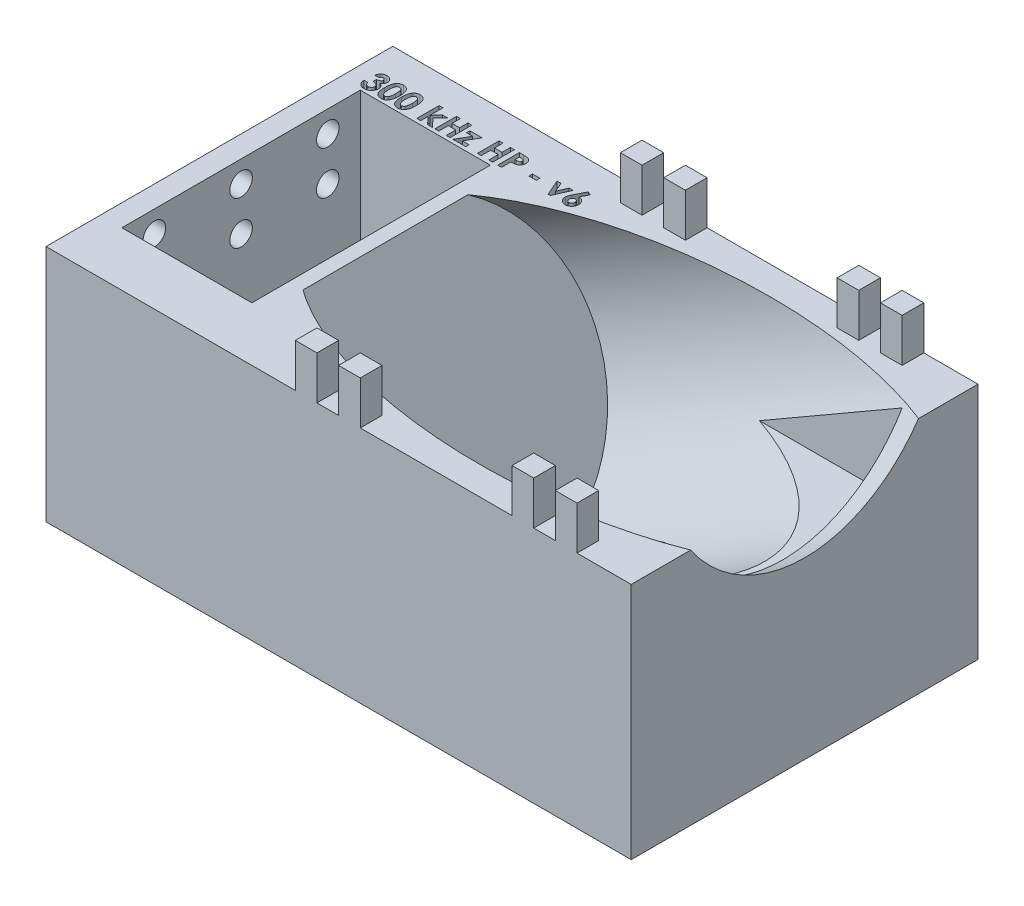
from build123d import *

# Parameters (mm, degrees)
SKETCH1_W                = 228.6
SKETCH1_H                = 127
BOSS_EXTRUDE1_DEPTH      = 50.8
SKETCH10_R               = 12.7
CUT_EXTRUDE6_DEPTH       = 196.514014843
SKETCH13_W               = 6.35
SKETCH13_H               = 6.35
BOSS_EXTRUDE3_DEPTH      = 12.7
SKETCH22_W               = 25.4
SKETCH22_H               = 101.6
CUT_EXTRUDE17_DEPTH      = 196.514014908
SKETCH23_W               = 254
SKETCH23_H               = 254
CUT_EXTRUDE18_DEPTH      = 57.15
SKETCH21_W               = 31.75
SKETCH21_H               = 101.6
CUT_EXTRUDE16_DEPTH      = 144.262530042
SKETCH26_W               = 88.9
SKETCH26_H               = 69.85
CUT_EXTRUDE21_DEPTH      = 25.4
CUT_EXTRUDE22_DEPTH      = 192.97594914
CUT_EXTRUDE22_DEPTH_BACK = 25.4
SKETCH27_R               = 3.302
SKETCH28_W               = 2.198076923
SKETCH28_H               = 1.058333333
CUT_EXTRUDE23_DEPTH      = 3.175
SKETCH30_R               = 3.429
CUT_EXTRUDE24_DEPTH      = 133.743860656
CUT_EXTRUDE25_DEPTH      = 133.743860656
CUT_EXTRUDE25_DEPTH_BACK = 38.1
SKETCH31_W               = 38.1
SKETCH31_H               = 69.85


with BuildPart() as part:
    # Sketch1 → Boss-Extrude1 (new, symmetric)
    with BuildSketch(Plane.XY):
        with Locations((-25.4, -63.5)):
            Rectangle(SKETCH1_W, SKETCH1_H)
    extrude(amount=BOSS_EXTRUDE1_DEPTH, both=True)

    # Sketch10 → Cut-Extrude6 (cut, through all)
    with BuildSketch(Plane.XZ.offset(127)):
        with Locations(Location((0, 0, 0), (0, 0, 270))):
            Circle(SKETCH10_R)
    extrude(amount=-CUT_EXTRUDE6_DEPTH, mode=Mode.SUBTRACT)

    # Sketch2 → Cut-Revolve1 (revolve, cut)
    with BuildSketch(Plane.XY):
        Polygon((0, 46.586734405), (-47.920101674, 18.920050804), (-69.397531628, 6.520050839), (-50.142509297, -26.830626138), (-48.125031628, -30.324999965), (0, -2.54), (87.988181024, 48.26), (66.715681024, 85.105050804), align=None)
    revolve(axis=Axis((-48.125031628, -30.324999965, 0), (0.8660254037844379, 0.5000000000000012, 0)), mode=Mode.SUBTRACT)

    # Sketch13 → Boss-Extrude3 (add)
    with BuildSketch(Plane(origin=(0, 0, 0), x_dir=(1, 0, 0), z_dir=(0, 1, 0))):
        with Locations((-38.1, 47.625)):
            Rectangle(SKETCH13_W, SKETCH13_H)
        with Locations((-25.4, 47.625)):
            Rectangle(SKETCH13_W, SKETCH13_H)
        with Locations((25.4, 47.625)):
            Rectangle(SKETCH13_W, SKETCH13_H)
        with Locations((38.1, 47.625)):
            Rectangle(SKETCH13_W, SKETCH13_H)
        with Locations((38.1, -47.625)):
            Rectangle(SKETCH13_W, SKETCH13_H)
        with Locations((25.4, -47.625)):
            Rectangle(SKETCH13_W, SKETCH13_H)
        with Locations((-25.4, -47.625)):
            Rectangle(SKETCH13_W, SKETCH13_H)
        with Locations((-38.1, -47.625)):
            Rectangle(SKETCH13_W, SKETCH13_H)
    extrude(amount=BOSS_EXTRUDE3_DEPTH)

    # Sketch22 → Cut-Extrude17 (cut, through all)
    with BuildSketch(Plane(origin=(0, 0, 0), x_dir=(1, 0, 0), z_dir=(0, 1, 0))):
        with Locations((-127, 0)):
            Rectangle(SKETCH22_W, SKETCH22_H)
    extrude(amount=-CUT_EXTRUDE17_DEPTH, mode=Mode.SUBTRACT)

    # Sketch23 → Cut-Extrude18 (cut)
    with BuildSketch(Plane.XZ.offset(127)):
        Rectangle(SKETCH23_W, SKETCH23_H)
    extrude(amount=-CUT_EXTRUDE18_DEPTH, mode=Mode.SUBTRACT)

    # Sketch21 → Cut-Extrude16 (cut, through all)
    with BuildSketch(Plane(origin=(0, 0, 0), x_dir=(1, 0, 0), z_dir=(0, 1, 0))):
        with Locations((73.025, 0)):
            Rectangle(SKETCH21_W, SKETCH21_H)
    extrude(amount=-CUT_EXTRUDE16_DEPTH, mode=Mode.SUBTRACT)

    # Sketch26 → Cut-Extrude21 (cut)
    with BuildSketch(Plane(origin=(0, 0, 0), x_dir=(1, 0, 0), z_dir=(0, 1, 0))):
        with Locations((6.35, 0)):
            Rectangle(SKETCH26_W, SKETCH26_H)
    extrude(amount=-CUT_EXTRUDE21_DEPTH, mode=Mode.SUBTRACT)

    # Sketch27 → Cut-Extrude22 (cut, two sides: drawn at the far end of the back side and taken through both)
    with BuildSketch(Plane.ZY.offset(114.3).offset(-CUT_EXTRUDE22_DEPTH_BACK)):
        with Locations(Location((-25.4, -6.35, 0), (0, 0, 180))):
            Circle(SKETCH27_R)
        with Locations(Location((0, -6.35, 0), (0, 0, 180))):
            Circle(SKETCH27_R)
        with Locations(Location((0, -19.05, 0), (0, 0, 180))):
            Circle(SKETCH27_R)
        with Locations(Location((25.4, -6.35, 0), (0, 0, 180))):
            Circle(SKETCH27_R)
        with Locations(Location((25.4, -19.05, 0), (0, 0, 180))):
            Circle(SKETCH27_R)
        with Locations(Location((-25.4, -19.05, 0), (0, 0, 180))):
            Circle(SKETCH27_R)
    extrude(amount=CUT_EXTRUDE22_DEPTH + CUT_EXTRUDE22_DEPTH_BACK, mode=Mode.SUBTRACT)

    # Sketch28 → Cut-Extrude23 (cut)
    # profile 1 of 11: a face of its own
    with BuildSketch(Plane(origin=(0, 0, 0), x_dir=(1, 0, 0), z_dir=(0, 1, 0))):
        with BuildLine():
            Line((-108.439595668, 40.823041991), (-109.579339258, 40.823041991))
            add(Edge.make_bspline(
                [(-109.579339258, 40.823041991), (-109.571292235, 40.880013707), (-109.555516579, 40.991702982), (-109.517767544, 41.15340123), (-109.472615625, 41.306783084), (-109.41624576, 41.451362816), (-109.35013308, 41.587397969), (-109.274949876, 41.71535535), (-109.18988339, 41.834685743), (-109.124679027, 41.906570845), (-109.092149755, 41.942433016)],
                knots=[0, 0, 0, 0, 1.111473889, 2.178970933, 3.205615836, 4.199322666, 5.174200091, 6.12565194, 7.064921805, 8, 8, 8, 8], degree=3))
            add(Edge.make_bspline(
                [(-109.092149755, 41.942433016), (-109.04523059, 41.989750553), (-108.952757848, 42.083008445), (-108.798225049, 42.202461503), (-108.636246138, 42.305840002), (-108.463572556, 42.387799223), (-108.282891233, 42.454135718), (-108.092765331, 42.498694091), (-107.893971771, 42.528258965), (-107.758320175, 42.531171208), (-107.689094867, 42.532657375)],
                knots=[0, 0, 0, 0, 1.01925491, 2.00884431, 2.983262333, 3.955970413, 4.92937149, 5.924503185, 6.940838805, 8, 8, 8, 8], degree=3))
            add(Edge.make_bspline(
                [(-107.689094867, 42.532657375), (-107.627550006, 42.531204422), (-107.506565211, 42.528348208), (-107.328748005, 42.505420072), (-107.15921418, 42.465206676), (-106.996171714, 42.412628563), (-106.84201843, 42.341087252), (-106.693352017, 42.258043018), (-106.554326218, 42.156185813), (-106.42461574, 42.041097423), (-106.305451927, 41.916618062), (-106.202255542, 41.783559862), (-106.113535759, 41.645477115), (-106.040442393, 41.501222613), (-105.984243527, 41.350552262), (-105.945239847, 41.194336462), (-105.919710992, 41.032919917), (-105.917167651, 40.923207266), (-105.915877719, 40.867563225)],
                knots=[0, 0, 0, 0, 1.091422571, 2.145516843, 3.172569842, 4.178562979, 5.178154469, 6.181868002, 7.194278174, 8.227918432, 9.254613415, 10.245994977, 11.209837596, 12.161663635, 13.10878368, 14.055455738, 15.013766427, 16, 16, 16, 16], degree=3))
            add(Edge.make_bspline(
                [(-105.915877719, 40.867563225), (-105.918524735, 40.798652714), (-105.923735896, 40.662989104), (-105.966497241, 40.464435331), (-106.033430374, 40.274582491), (-106.130121795, 40.09608691), (-106.251010699, 39.929434354), (-106.399337334, 39.780196517), (-106.570876975, 39.646033552), (-106.699654067, 39.573934358), (-106.765597271, 39.537014347)],
                knots=[0, 0, 0, 0, 0.992805628, 1.954529043, 2.915727527, 3.886831945, 4.871318353, 5.87440735, 6.911542536, 8, 8, 8, 8], degree=3))
            add(Edge.make_bspline(
                [(-106.765597271, 39.537014347), (-106.720334868, 39.522153747), (-106.631396276, 39.492953334), (-106.504980761, 39.435443453), (-106.384774052, 39.372594684), (-106.272846064, 39.299580983), (-106.16808354, 39.2193547), (-106.071125122, 39.13123003), (-105.981391508, 39.035399128), (-105.900347562, 38.931334959), (-105.828417893, 38.820701827), (-105.763879232, 38.706055293), (-105.710760316, 38.58565672), (-105.665761981, 38.460881142), (-105.631502811, 38.330607142), (-105.607381294, 38.195339519), (-105.593438465, 38.05538683), (-105.591311945, 37.960568968), (-105.590236694, 37.912625324)],
                knots=[0, 0, 0, 0, 1.059543567, 2.081955587, 3.086750234, 4.076226789, 5.052108497, 6.020845489, 6.989030705, 7.970690546, 8.952259656, 9.923888338, 10.895517021, 11.877585046, 12.873342345, 13.889638361, 14.932918083, 16, 16, 16, 16], degree=3))
            add(Edge.make_bspline(
                [(-105.590236694, 37.912625324), (-105.592416374, 37.842167634), (-105.596714258, 37.703239418), (-105.624038199, 37.498612373), (-105.674910453, 37.303518667), (-105.741835722, 37.11571345), (-105.831106766, 36.937621221), (-105.936163778, 36.765155005), (-106.065299953, 36.604295884), (-106.208812638, 36.450791159), (-106.368191842, 36.311231537), (-106.540984827, 36.190239624), (-106.723392024, 36.086407035), (-106.916567472, 36.002112782), (-107.120444057, 35.937196566), (-107.334567356, 35.890272133), (-107.559837056, 35.861562988), (-107.713601251, 35.858553379), (-107.792129723, 35.85701635)],
                knots=[0, 0, 0, 0, 1.005138573, 1.981928558, 2.936866704, 3.876260664, 4.820238198, 5.773547, 6.751179199, 7.756627054, 8.768222608, 9.766606018, 10.760583154, 11.757261445, 12.767156078, 13.807575856, 14.880313354, 16, 16, 16, 16], degree=3))
            add(Edge.make_bspline(
                [(-107.792129723, 35.85701635), (-107.86641639, 35.858636887), (-108.011674137, 35.861805633), (-108.224143994, 35.889232737), (-108.426076481, 35.933474881), (-108.617986934, 35.995837851), (-108.799132866, 36.076711966), (-108.971156979, 36.173014891), (-109.13062657, 36.290301154), (-109.279318443, 36.423276232), (-109.413934166, 36.57246672), (-109.53424892, 36.734416693), (-109.637609746, 36.909741981), (-109.724440526, 37.097693522), (-109.79406244, 37.298601039), (-109.848980002, 37.512055976), (-109.887340818, 37.738475358), (-109.899023685, 37.894256709), (-109.904980283, 37.973683016)],
                knots=[0, 0, 0, 0, 1.066544725, 2.085487077, 3.070979577, 4.031932826, 4.977951092, 5.916076795, 6.857635327, 7.814973522, 8.776389752, 9.738577119, 10.707772778, 11.69409279, 12.707140348, 13.757286496, 14.856535458, 16, 16, 16, 16], degree=3))
            Line((-109.904980283, 37.973683016), (-108.765236694, 37.973683016))
            add(Edge.make_bspline(
                [(-108.765236694, 37.973683016), (-108.758014257, 37.933746426), (-108.743946669, 37.855959444), (-108.7165087, 37.743341187), (-108.680753198, 37.639387579), (-108.639410942, 37.543174684), (-108.594755082, 37.453439261), (-108.540800124, 37.373495461), (-108.481499604, 37.301172481), (-108.395928521, 37.215194125), (-108.273598765, 37.126854954), (-108.108413067, 37.050084011), (-107.92465962, 37.005086807), (-107.796197635, 36.999597286), (-107.729799995, 36.996759939)],
                knots=[0, 0, 0, 0, 0.928156231, 1.807827665, 2.648129825, 3.438902246, 4.202261636, 4.936546065, 5.639352463, 6.338805438, 7.70633318, 9.064371875, 10.482673459, 12, 12, 12, 12], degree=3))
            add(Edge.make_bspline(
                [(-107.729799995, 36.996759939), (-107.69456706, 36.997364126), (-107.625553623, 36.998547592), (-107.524183161, 37.011664725), (-107.427613522, 37.033268655), (-107.335664841, 37.062627594), (-107.247751768, 37.09943086), (-107.165553968, 37.146886469), (-107.087396046, 37.202060389), (-107.01412765, 37.264090522), (-106.946426141, 37.331681163), (-106.890094505, 37.406526313), (-106.838611465, 37.482582364), (-106.800534238, 37.564825169), (-106.767170384, 37.648829187), (-106.746750001, 37.7376435), (-106.731331146, 37.829405024), (-106.730435064, 37.892202582), (-106.729980283, 37.924073641)],
                knots=[0, 0, 0, 0, 1.110435564, 2.175094844, 3.216326037, 4.226890168, 5.215276772, 6.21526065, 7.213097102, 8.228249917, 9.239874822, 10.221364777, 11.178138315, 12.128914389, 13.072518965, 14.022636769, 14.996447288, 16, 16, 16, 16], degree=3))
            add(Edge.make_bspline(
                [(-106.729980283, 37.924073641), (-106.73118764, 37.958930074), (-106.733591209, 38.028321246), (-106.753228623, 38.129583069), (-106.784240251, 38.226988782), (-106.827319189, 38.320107026), (-106.88484631, 38.408594586), (-106.952727671, 38.49422679), (-107.036311201, 38.572546634), (-107.128013528, 38.649963427), (-107.234352201, 38.717447522), (-107.350148378, 38.779725426), (-107.478445363, 38.829279411), (-107.616111312, 38.873540297), (-107.765750304, 38.905867762), (-107.926433137, 38.929340651), (-108.097900607, 38.94681258), (-108.216095362, 38.949319216), (-108.276775155, 38.950606093)],
                knots=[0, 0, 0, 0, 0.809814727, 1.612155564, 2.388397, 3.182215007, 3.988903953, 4.837162975, 5.715530372, 6.646997145, 7.623086902, 8.637258368, 9.698941581, 10.815059213, 11.996518529, 13.252603015, 14.589518788, 16, 16, 16, 16], degree=3))
            Line((-108.276775155, 38.950606093), (-108.276775155, 40.008939427))
            add(Edge.make_bspline(
                [(-108.276775155, 40.008939427), (-108.201225204, 40.015373502), (-108.059886206, 40.027410384), (-107.863700099, 40.055559049), (-107.698536686, 40.093184375), (-107.560426262, 40.138577293), (-107.445748216, 40.196873627), (-107.345566107, 40.261230206), (-107.259284537, 40.335970966), (-107.186365035, 40.418867149), (-107.128031703, 40.507889877), (-107.086746769, 40.601655471), (-107.059484355, 40.69726271), (-107.056901244, 40.762655179), (-107.055621309, 40.795057215)],
                knots=[0, 0, 0, 0, 1.70044513, 3.18119609, 4.440695891, 5.496282586, 6.431922213, 7.318171381, 8.16090191, 8.983045123, 9.787564368, 10.536848927, 11.275007137, 12, 12, 12, 12], degree=3))
            add(Edge.make_bspline(
                [(-107.055621309, 40.795057215), (-107.057829562, 40.836398695), (-107.062139605, 40.917088511), (-107.095613734, 41.032572635), (-107.153721029, 41.135517161), (-107.231632708, 41.225705463), (-107.326570798, 41.301037492), (-107.437854882, 41.355727261), (-107.56307009, 41.387859942), (-107.651165735, 41.391191018), (-107.696727078, 41.392913786)],
                knots=[0, 0, 0, 0, 1.009664648, 1.970651636, 2.907870547, 3.878035693, 4.867062054, 5.849714035, 6.887914197, 8, 8, 8, 8], degree=3))
            add(Edge.make_bspline(
                [(-107.696727078, 41.392913786), (-107.738023313, 41.390881101), (-107.819967691, 41.386847633), (-107.939794899, 41.356742892), (-108.053590825, 41.306065308), (-108.158999075, 41.236183907), (-108.254498061, 41.152259306), (-108.332875175, 41.052868036), (-108.398065543, 40.9439648), (-108.425698023, 40.863507611), (-108.439595668, 40.823041991)],
                knots=[0, 0, 0, 0, 0.98818071, 1.960853194, 2.938124878, 3.957524365, 4.978590984, 5.968022688, 6.978025184, 8, 8, 8, 8], degree=3))
        make_face()
    # profile 2 of 11: a face of its own
    with BuildSketch(Plane(origin=(0, 0, 0), x_dir=(1, 0, 0), z_dir=(0, 1, 0))):
        with BuildLine():
            add(Edge.make_bspline(
                [(-102.882073633, 42.532657375), (-102.826905313, 42.531838386), (-102.718429655, 42.530228034), (-102.55866543, 42.512786614), (-102.40476831, 42.486437491), (-102.25613623, 42.449689654), (-102.113839057, 42.401055199), (-101.976841125, 42.342840591), (-101.846773105, 42.271992353), (-101.721976214, 42.19196563), (-101.602498525, 42.101364034), (-101.491211599, 41.998073537), (-101.386083101, 41.884470857), (-101.289388676, 41.758838526), (-101.198986996, 41.622319302), (-101.115175106, 41.474891538), (-101.038594608, 41.315833674), (-100.968387215, 41.144858678), (-100.905607543, 40.959403708), (-100.852728303, 40.757341515), (-100.807375507, 40.538625954), (-100.769094546, 40.302712611), (-100.740160327, 40.049287898), (-100.720658081, 39.77852018), (-100.707274717, 39.490931456), (-100.70618246, 39.293647954), (-100.705621309, 39.192292792)],
                knots=[0, 0, 0, 0, 0.879237366, 1.728815576, 2.559023295, 3.367336655, 4.166867292, 4.954216142, 5.737608147, 6.525189134, 7.316157332, 8.124696809, 8.942788509, 9.781158001, 10.649253743, 11.551476218, 12.482711956, 13.461909668, 14.496590415, 15.601789533, 16.789733467, 18.056700938, 19.410929216, 20.8549011, 22.384193279, 24, 24, 24, 24], degree=3))
            add(Edge.make_bspline(
                [(-100.705621309, 39.192292792), (-100.706227762, 39.089669563), (-100.707406089, 38.89027447), (-100.720101731, 38.600055314), (-100.741964227, 38.327321659), (-100.770142189, 38.072101723), (-100.80873829, 37.834530282), (-100.853939689, 37.613992186), (-100.907653612, 37.410567376), (-100.972501226, 37.22471421), (-101.042283652, 37.053438944), (-101.119073631, 36.894691206), (-101.201532725, 36.748041017), (-101.287769572, 36.611275962), (-101.382511992, 36.488427804), (-101.481148604, 36.375319063), (-101.587974223, 36.276258196), (-101.698491078, 36.186140052), (-101.816747847, 36.10825989), (-101.94152498, 36.040147184), (-102.075047036, 35.984899691), (-102.214880136, 35.936848371), (-102.363407762, 35.902352709), (-102.518269832, 35.874981534), (-102.681214706, 35.859854544), (-102.79215414, 35.857977941), (-102.849000716, 35.85701635)],
                knots=[0, 0, 0, 0, 1.643780988, 3.193836972, 4.651895693, 6.025988579, 7.305620092, 8.505800249, 9.631074763, 10.672816429, 11.65661981, 12.592235626, 13.49536222, 14.350718032, 15.179365177, 15.97804903, 16.751647189, 17.51006938, 18.259804725, 19.016521909, 19.783502495, 20.571750527, 21.382245291, 22.22305063, 23.089471752, 24, 24, 24, 24], degree=3))
            add(Edge.make_bspline(
                [(-102.849000716, 35.85701635), (-102.905845758, 35.85799649), (-103.01720436, 35.85991657), (-103.180589853, 35.874869058), (-103.336272614, 35.90246359), (-103.485975333, 35.937113203), (-103.628656102, 35.984793372), (-103.764999071, 36.041693832), (-103.893955882, 36.109381548), (-104.015883594, 36.187443163), (-104.130365913, 36.276958349), (-104.239181892, 36.37696964), (-104.342090825, 36.487223534), (-104.437527211, 36.608954965), (-104.527054023, 36.740539073), (-104.609737636, 36.883478484), (-104.685528362, 37.037565081), (-104.756796946, 37.203013646), (-104.818720325, 37.383386097), (-104.873829257, 37.580293136), (-104.918973045, 37.795376147), (-104.955280699, 38.028566031), (-104.98426871, 38.279368765), (-105.005832458, 38.547905405), (-105.018598619, 38.834301029), (-105.019764588, 39.031155007), (-105.020364899, 39.132507135)],
                knots=[0, 0, 0, 0, 0.917216111, 1.796812873, 2.643793957, 3.46689424, 4.273913431, 5.068098542, 5.848489301, 6.620921603, 7.401012384, 8.190319798, 9.003608147, 9.831726257, 10.68377682, 11.569763213, 12.493818149, 13.453288342, 14.474581811, 15.568529029, 16.750744269, 18.018426408, 19.375425659, 20.823733699, 22.36466933, 24, 24, 24, 24], degree=3))
            add(Edge.make_bspline(
                [(-105.020364899, 39.132507135), (-105.019277492, 39.273327938), (-105.017179328, 39.545043491), (-104.990589845, 39.937593463), (-104.951563229, 40.300437914), (-104.894242373, 40.632969892), (-104.823365929, 40.936421), (-104.732604951, 41.208792261), (-104.62928018, 41.453852541), (-104.5412342, 41.599027727), (-104.498830444, 41.668945436)],
                knots=[0, 0, 0, 0, 1.288568992, 2.486310467, 3.599230591, 4.627010532, 5.572937695, 6.447898582, 7.252493626, 8, 8, 8, 8], degree=3))
            add(Edge.make_bspline(
                [(-104.498830444, 41.668945436), (-104.449525375, 41.737632572), (-104.353124251, 41.871929459), (-104.184564191, 42.048236167), (-104.003468352, 42.199022297), (-103.80611713, 42.320875424), (-103.595631717, 42.416968809), (-103.370204987, 42.484838486), (-103.130669404, 42.524382521), (-102.966176324, 42.529857901), (-102.882073633, 42.532657375)],
                knots=[0, 0, 0, 0, 1.058512271, 2.069600068, 3.047294572, 4.004278952, 4.967380941, 5.939006123, 6.946246673, 8, 8, 8, 8], degree=3))
        make_face()
        with BuildLine():
            add(Edge.make_bspline(
                [(-102.854088857, 41.392913786), (-102.903961476, 41.390549923), (-103.001738283, 41.385915496), (-103.143617089, 41.346575756), (-103.277399945, 41.285813406), (-103.37916499, 41.212695417), (-103.455335114, 41.142603057), (-103.508555726, 41.07917175), (-103.559878618, 41.008386984), (-103.60520958, 40.927054605), (-103.648013842, 40.838096982), (-103.689846508, 40.7411103), (-103.72413831, 40.633712357), (-103.757829096, 40.517732154), (-103.787345368, 40.389963146), (-103.812073533, 40.249360963), (-103.834165975, 40.095011255), (-103.849575717, 39.926812923), (-103.86394222, 39.744941945), (-103.874240811, 39.548993182), (-103.878546393, 39.339019497), (-103.879915006, 39.194413736), (-103.880621309, 39.119786782)],
                knots=[0, 0, 0, 0, 1.076674018, 2.110852608, 3.161083442, 4.239746716, 4.804137807, 5.395870207, 6.026861976, 6.692161227, 7.405688833, 8.16177676, 8.973626916, 9.841385931, 10.773283133, 11.807421078, 12.927755683, 14.143907515, 15.458935494, 16.872852025, 18.386167141, 20, 20, 20, 20], degree=3))
            add(Edge.make_bspline(
                [(-103.880621309, 39.119786782), (-103.87945882, 39.023103956), (-103.877229662, 38.837707467), (-103.865554372, 38.571100861), (-103.842152222, 38.328467382), (-103.813044673, 38.108162613), (-103.772161932, 37.911615289), (-103.725123692, 37.73696589), (-103.667035647, 37.586440772), (-103.59990372, 37.457863004), (-103.525552085, 37.348482163), (-103.444840115, 37.255507956), (-103.360515762, 37.174996679), (-103.26994699, 37.109598361), (-103.173349869, 37.059480104), (-103.071530807, 37.023430661), (-102.964425099, 37.001363296), (-102.891080214, 36.998303262), (-102.854088857, 36.996759939)],
                knots=[0, 0, 0, 0, 1.771748488, 3.397459088, 4.888034009, 6.237357457, 7.467047327, 8.564189669, 9.548206622, 10.417051504, 11.216568818, 11.965764335, 12.669334354, 13.348544111, 14.005342236, 14.656555988, 15.322436492, 16, 16, 16, 16], degree=3))
            add(Edge.make_bspline(
                [(-102.854088857, 36.996759939), (-102.818366926, 36.997815995), (-102.748427827, 36.999883622), (-102.646440957, 37.021107527), (-102.549994925, 37.055612988), (-102.459380933, 37.104423385), (-102.374274868, 37.166493273), (-102.295092674, 37.242095413), (-102.222431528, 37.331983383), (-102.180098815, 37.398693551), (-102.158285572, 37.433068032)],
                knots=[0, 0, 0, 0, 0.992283464, 1.942767638, 2.88273346, 3.832339453, 4.79467288, 5.803907806, 6.868395428, 8, 8, 8, 8], degree=3))
            add(Edge.make_bspline(
                [(-102.158285572, 37.433068032), (-102.132604152, 37.480039663), (-102.078752298, 37.578535363), (-102.01643484, 37.744743184), (-101.963979477, 37.932198135), (-101.918831912, 38.141483595), (-101.887953733, 38.373425011), (-101.861361482, 38.626551622), (-101.848535379, 38.902138072), (-101.846449143, 39.093065359), (-101.845364899, 39.192292792)],
                knots=[0, 0, 0, 0, 0.710965849, 1.490837728, 2.352621235, 3.297892224, 4.334225155, 5.461620853, 6.680770821, 8, 8, 8, 8], degree=3))
            add(Edge.make_bspline(
                [(-101.845364899, 39.192292792), (-101.845783719, 39.292381567), (-101.846589876, 39.485035374), (-101.861380526, 39.761612576), (-101.881977637, 40.014219949), (-101.912105264, 40.242293522), (-101.950869932, 40.446386958), (-101.998647532, 40.626486915), (-102.054973767, 40.782948336), (-102.12176997, 40.915615207), (-102.195750915, 41.028363849), (-102.274283947, 41.125093438), (-102.357701135, 41.20767872), (-102.445862978, 41.27643048), (-102.540810013, 41.32896198), (-102.640728629, 41.366053565), (-102.745823665, 41.38849273), (-102.817513358, 41.391420209), (-102.854088857, 41.392913786)],
                knots=[0, 0, 0, 0, 1.793836731, 3.452829483, 4.963243077, 6.335886805, 7.574563692, 8.684454726, 9.672768357, 10.54971625, 11.340229787, 12.085688095, 12.778991901, 13.440269426, 14.083255152, 14.715733572, 15.344777694, 16, 16, 16, 16], degree=3))
        make_face(mode=Mode.SUBTRACT)
    # profile 3 of 11: a face of its own
    with BuildSketch(Plane(origin=(0, 0, 0), x_dir=(1, 0, 0), z_dir=(0, 1, 0))):
        with BuildLine():
            add(Edge.make_bspline(
                [(-97.997458248, 42.532657375), (-97.942289928, 42.531838386), (-97.83381427, 42.530228034), (-97.674050046, 42.512786614), (-97.520152926, 42.486437491), (-97.371520845, 42.449689654), (-97.229223673, 42.401055199), (-97.092225741, 42.342840591), (-96.962157721, 42.271992353), (-96.83736083, 42.19196563), (-96.71788314, 42.101364034), (-96.606596214, 41.998073537), (-96.501467716, 41.884470857), (-96.404773291, 41.758838526), (-96.314371611, 41.622319302), (-96.230559722, 41.474891538), (-96.153979223, 41.315833674), (-96.083771831, 41.144858678), (-96.020992158, 40.959403708), (-95.968112919, 40.757341515), (-95.922760122, 40.538625954), (-95.884479162, 40.302712611), (-95.855544943, 40.049287898), (-95.836042697, 39.77852018), (-95.822659333, 39.490931456), (-95.821567076, 39.293647954), (-95.821005924, 39.192292792)],
                knots=[0, 0, 0, 0, 0.879237366, 1.728815576, 2.559023295, 3.367336655, 4.166867292, 4.954216142, 5.737608147, 6.525189134, 7.316157332, 8.124696809, 8.942788509, 9.781158001, 10.649253743, 11.551476218, 12.482711956, 13.461909668, 14.496590415, 15.601789533, 16.789733467, 18.056700938, 19.410929216, 20.8549011, 22.384193279, 24, 24, 24, 24], degree=3))
            add(Edge.make_bspline(
                [(-95.821005924, 39.192292792), (-95.821612377, 39.089669563), (-95.822790704, 38.89027447), (-95.835486347, 38.600055314), (-95.857348842, 38.327321659), (-95.885526805, 38.072101723), (-95.924122905, 37.834530282), (-95.969324304, 37.613992186), (-96.023038227, 37.410567376), (-96.087885842, 37.22471421), (-96.157668267, 37.053438944), (-96.234458246, 36.894691206), (-96.316917341, 36.748041017), (-96.403154187, 36.611275962), (-96.497896607, 36.488427804), (-96.59653322, 36.375319063), (-96.703358839, 36.276258196), (-96.813875693, 36.186140052), (-96.932132462, 36.10825989), (-97.056909595, 36.040147184), (-97.190431651, 35.984899691), (-97.330264751, 35.936848371), (-97.478792377, 35.902352709), (-97.633654447, 35.874981534), (-97.796599321, 35.859854544), (-97.907538755, 35.857977941), (-97.964385332, 35.85701635)],
                knots=[0, 0, 0, 0, 1.643780988, 3.193836972, 4.651895693, 6.025988579, 7.305620092, 8.505800249, 9.631074763, 10.672816429, 11.65661981, 12.592235626, 13.49536222, 14.350718032, 15.179365177, 15.97804903, 16.751647189, 17.51006938, 18.259804725, 19.016521909, 19.783502495, 20.571750527, 21.382245291, 22.22305063, 23.089471752, 24, 24, 24, 24], degree=3))
            add(Edge.make_bspline(
                [(-97.964385332, 35.85701635), (-98.021230374, 35.85799649), (-98.132588975, 35.85991657), (-98.295974469, 35.874869058), (-98.451657229, 35.90246359), (-98.601359948, 35.937113203), (-98.744040717, 35.984793372), (-98.880383687, 36.041693832), (-99.009340497, 36.109381548), (-99.131268209, 36.187443163), (-99.245750528, 36.276958349), (-99.354566507, 36.37696964), (-99.45747544, 36.487223534), (-99.552911827, 36.608954965), (-99.642438638, 36.740539073), (-99.725122252, 36.883478484), (-99.800912977, 37.037565081), (-99.872181562, 37.203013646), (-99.93410494, 37.383386097), (-99.989213872, 37.580293136), (-100.03435766, 37.795376147), (-100.070665315, 38.028566031), (-100.099653325, 38.279368765), (-100.121217073, 38.547905405), (-100.133983234, 38.834301029), (-100.135149204, 39.031155007), (-100.135749514, 39.132507135)],
                knots=[0, 0, 0, 0, 0.917216111, 1.796812873, 2.643793957, 3.46689424, 4.273913431, 5.068098542, 5.848489301, 6.620921603, 7.401012384, 8.190319798, 9.003608147, 9.831726257, 10.68377682, 11.569763213, 12.493818149, 13.453288342, 14.474581811, 15.568529029, 16.750744269, 18.018426408, 19.375425659, 20.823733699, 22.36466933, 24, 24, 24, 24], degree=3))
            add(Edge.make_bspline(
                [(-100.135749514, 39.132507135), (-100.134662108, 39.273327938), (-100.132563943, 39.545043491), (-100.105974461, 39.937593463), (-100.066947844, 40.300437914), (-100.009626989, 40.632969892), (-99.938750544, 40.936421), (-99.847989566, 41.208792261), (-99.744664795, 41.453852541), (-99.656618816, 41.599027727), (-99.614215059, 41.668945436)],
                knots=[0, 0, 0, 0, 1.288568992, 2.486310467, 3.599230591, 4.627010532, 5.572937695, 6.447898582, 7.252493626, 8, 8, 8, 8], degree=3))
            add(Edge.make_bspline(
                [(-99.614215059, 41.668945436), (-99.564909991, 41.737632572), (-99.468508867, 41.871929459), (-99.299948806, 42.048236167), (-99.118852968, 42.199022297), (-98.921501746, 42.320875424), (-98.711016332, 42.416968809), (-98.485589602, 42.484838486), (-98.246054019, 42.524382521), (-98.081560939, 42.529857901), (-97.997458248, 42.532657375)],
                knots=[0, 0, 0, 0, 1.058512271, 2.069600068, 3.047294572, 4.004278952, 4.967380941, 5.939006123, 6.946246673, 8, 8, 8, 8], degree=3))
        make_face()
        with BuildLine():
            add(Edge.make_bspline(
                [(-97.969473473, 41.392913786), (-98.019346092, 41.390549923), (-98.117122899, 41.385915496), (-98.259001705, 41.346575756), (-98.39278456, 41.285813406), (-98.494549605, 41.212695417), (-98.570719729, 41.142603057), (-98.623940341, 41.07917175), (-98.675263233, 41.008386984), (-98.720594196, 40.927054605), (-98.763398458, 40.838096982), (-98.805231124, 40.7411103), (-98.839522925, 40.633712357), (-98.873213711, 40.517732154), (-98.902729983, 40.389963146), (-98.927458148, 40.249360963), (-98.94955059, 40.095011255), (-98.964960332, 39.926812923), (-98.979326836, 39.744941945), (-98.989625426, 39.548993182), (-98.993931008, 39.339019497), (-98.995299622, 39.194413736), (-98.996005924, 39.119786782)],
                knots=[0, 0, 0, 0, 1.076674018, 2.110852608, 3.161083442, 4.239746716, 4.804137807, 5.395870207, 6.026861976, 6.692161227, 7.405688833, 8.16177676, 8.973626916, 9.841385931, 10.773283133, 11.807421078, 12.927755683, 14.143907515, 15.458935494, 16.872852025, 18.386167141, 20, 20, 20, 20], degree=3))
            add(Edge.make_bspline(
                [(-98.996005924, 39.119786782), (-98.994843436, 39.023103956), (-98.992614277, 38.837707467), (-98.980938987, 38.571100861), (-98.957536838, 38.328467382), (-98.928429289, 38.108162613), (-98.887546547, 37.911615289), (-98.840508307, 37.73696589), (-98.782420263, 37.586440772), (-98.715288335, 37.457863004), (-98.6409367, 37.348482163), (-98.56022473, 37.255507956), (-98.475900378, 37.174996679), (-98.385331606, 37.109598361), (-98.288734485, 37.059480104), (-98.186915422, 37.023430661), (-98.079809714, 37.001363296), (-98.00646483, 36.998303262), (-97.969473473, 36.996759939)],
                knots=[0, 0, 0, 0, 1.771748488, 3.397459088, 4.888034009, 6.237357457, 7.467047327, 8.564189669, 9.548206622, 10.417051504, 11.216568818, 11.965764335, 12.669334354, 13.348544111, 14.005342236, 14.656555988, 15.322436492, 16, 16, 16, 16], degree=3))
            add(Edge.make_bspline(
                [(-97.969473473, 36.996759939), (-97.933751541, 36.997815995), (-97.863812442, 36.999883622), (-97.761825572, 37.021107527), (-97.665379541, 37.055612988), (-97.574765549, 37.104423385), (-97.489659483, 37.166493273), (-97.410477289, 37.242095413), (-97.337816143, 37.331983383), (-97.29548343, 37.398693551), (-97.273670187, 37.433068032)],
                knots=[0, 0, 0, 0, 0.992283464, 1.942767638, 2.88273346, 3.832339453, 4.79467288, 5.803907806, 6.868395428, 8, 8, 8, 8], degree=3))
            add(Edge.make_bspline(
                [(-97.273670187, 37.433068032), (-97.247988768, 37.480039663), (-97.194136914, 37.578535363), (-97.131819455, 37.744743184), (-97.079364092, 37.932198135), (-97.034216528, 38.141483595), (-97.003338348, 38.373425011), (-96.976746097, 38.626551622), (-96.963919994, 38.902138072), (-96.961833758, 39.093065359), (-96.960749514, 39.192292792)],
                knots=[0, 0, 0, 0, 0.710965849, 1.490837728, 2.352621235, 3.297892224, 4.334225155, 5.461620853, 6.680770821, 8, 8, 8, 8], degree=3))
            add(Edge.make_bspline(
                [(-96.960749514, 39.192292792), (-96.961168334, 39.292381567), (-96.961974492, 39.485035374), (-96.976765142, 39.761612576), (-96.997362252, 40.014219949), (-97.027489879, 40.242293522), (-97.066254547, 40.446386958), (-97.114032147, 40.626486915), (-97.170358383, 40.782948336), (-97.237154586, 40.915615207), (-97.311135531, 41.028363849), (-97.389668562, 41.125093438), (-97.47308575, 41.20767872), (-97.561247593, 41.27643048), (-97.656194629, 41.32896198), (-97.756113244, 41.366053565), (-97.86120828, 41.38849273), (-97.932897973, 41.391420209), (-97.969473473, 41.392913786)],
                knots=[0, 0, 0, 0, 1.793836731, 3.452829483, 4.963243077, 6.335886805, 7.574563692, 8.684454726, 9.672768357, 10.54971625, 11.340229787, 12.085688095, 12.778991901, 13.440269426, 14.083255152, 14.715733572, 15.344777694, 16, 16, 16, 16], degree=3))
        make_face(mode=Mode.SUBTRACT)
    # profile 4 of 11: a face of its own
    with BuildSketch(Plane(origin=(0, 0, 0), x_dir=(1, 0, 0), z_dir=(0, 1, 0))):
        Polygon((-92.483185412, 42.532657375), (-91.343441822, 42.532657375), (-91.343441822, 38.7343601), (-89.570224674, 40.660221478), (-88.162081646, 40.660221478), (-90.198610091, 38.448152167), (-87.870785572, 36.019836863), (-89.305641341, 36.019836863), (-91.343441822, 38.145407776), (-91.343441822, 36.019836863), (-92.483185412, 36.019836863), align=None)
    # profile 5 of 11: a face of its own
    with BuildSketch(Plane(origin=(0, 0, 0), x_dir=(1, 0, 0), z_dir=(0, 1, 0))):
        Polygon((-87.191518745, 42.369836863), (-86.051775155, 42.369836863), (-86.051775155, 39.92752917), (-83.853698232, 39.92752917), (-83.853698232, 42.369836863), (-82.713954642, 42.369836863), (-82.713954642, 36.019836863), (-83.853698232, 36.019836863), (-83.853698232, 38.78778558), (-86.051775155, 38.78778558), (-86.051775155, 36.019836863), (-87.191518745, 36.019836863), align=None)
    # profile 6 of 11: a face of its own
    with BuildSketch(Plane(origin=(0, 0, 0), x_dir=(1, 0, 0), z_dir=(0, 1, 0))):
        Polygon((-81.574211053, 40.660221478), (-77.992159771, 40.660221478), (-80.126634931, 36.996759939), (-78.154980283, 36.996759939), (-78.154980283, 36.019836863), (-81.899852078, 36.019836863), (-79.765376918, 39.683298401), (-81.574211053, 39.683298401), align=None)
    # profile 7 of 11: a face of its own
    with BuildSketch(Plane(origin=(0, 0, 0), x_dir=(1, 0, 0), z_dir=(0, 1, 0))):
        Polygon((-74.735749514, 42.369836863), (-73.596005924, 42.369836863), (-73.596005924, 39.92752917), (-71.397929001, 39.92752917), (-71.397929001, 42.369836863), (-70.258185412, 42.369836863), (-70.258185412, 36.019836863), (-71.397929001, 36.019836863), (-71.397929001, 38.78778558), (-73.596005924, 38.78778558), (-73.596005924, 36.019836863), (-74.735749514, 36.019836863), align=None)
    # profile 8 of 11: a face of its own
    with BuildSketch(Plane(origin=(0, 0, 0), x_dir=(1, 0, 0), z_dir=(0, 1, 0))):
        with BuildLine():
            Line((-68.792800796, 42.369836863), (-67.52076554, 42.369836863))
            add(Edge.make_bspline(
                [(-67.52076554, 42.369836863), (-67.437652406, 42.36946483), (-67.27730975, 42.368747103), (-67.046082448, 42.360043698), (-66.832763941, 42.344446666), (-66.637403237, 42.325171201), (-66.460080665, 42.298147749), (-66.300574163, 42.267167478), (-66.158850631, 42.229424491), (-66.033311923, 42.184624088), (-65.920644989, 42.131806163), (-65.81402573, 42.075551303), (-65.715863754, 42.008413112), (-65.62120453, 41.937627459), (-65.535459889, 41.856432217), (-65.453280566, 41.770231048), (-65.378147081, 41.675605284), (-65.309711291, 41.573700345), (-65.247629486, 41.466398998), (-65.193390667, 41.35350942), (-65.149395174, 41.234852976), (-65.112488427, 41.111197237), (-65.082844568, 40.982547592), (-65.063112671, 40.848112836), (-65.049709775, 40.708831642), (-65.048527154, 40.614036774), (-65.047929001, 40.566090869)],
                knots=[0, 0, 0, 0, 1.698747864, 3.27724071, 4.728299578, 6.070144658, 7.288476769, 8.393259625, 9.389771311, 10.283485332, 11.113357557, 11.931608583, 12.74405601, 13.541433047, 14.344816069, 15.154114104, 15.974336324, 16.810834471, 17.661136416, 18.50621059, 19.367396281, 20.244825668, 21.142564693, 22.063065223, 23.020325768, 24, 24, 24, 24], degree=3))
            add(Edge.make_bspline(
                [(-65.047929001, 40.566090869), (-65.048794454, 40.513049456), (-65.050495173, 40.408816563), (-65.067167709, 40.256023928), (-65.095649666, 40.110349985), (-65.132874095, 39.970566238), (-65.184780914, 39.838972441), (-65.244082017, 39.712428724), (-65.317041184, 39.594482986), (-65.400408695, 39.483659867), (-65.491455529, 39.379058322), (-65.592343132, 39.283698524), (-65.701148544, 39.196930408), (-65.817241929, 39.117844638), (-65.941059137, 39.046600746), (-66.072510828, 38.982531611), (-66.212494627, 38.92768636), (-66.309975134, 38.899002739), (-66.359397351, 38.88446026)],
                knots=[0, 0, 0, 0, 1.102006807, 2.165578795, 3.188629044, 4.184801286, 5.166646146, 6.124351954, 7.085497154, 8.042432466, 9.003981491, 9.963833307, 10.922997304, 11.89326795, 12.880200226, 13.889073926, 14.929769137, 16, 16, 16, 16], degree=3))
            add(Edge.make_bspline(
                [(-66.359397351, 38.88446026), (-66.391949666, 38.876361191), (-66.462468463, 38.858816), (-66.579157703, 38.841003228), (-66.7136298, 38.824625479), (-66.866319591, 38.810550787), (-67.037315104, 38.800983275), (-67.226450772, 38.793511474), (-67.433812308, 38.788078704), (-67.57800332, 38.787885925), (-67.653057207, 38.78778558)],
                knots=[0, 0, 0, 0, 0.618981996, 1.340914327, 2.176866532, 3.120127938, 4.170906482, 5.338178032, 6.614476169, 8, 8, 8, 8], degree=3))
            Line((-67.653057207, 38.78778558), (-67.653057207, 36.019836863))
            Line((-67.653057207, 36.019836863), (-68.792800796, 36.019836863))
            Line((-68.792800796, 36.019836863), (-68.792800796, 42.369836863))
        make_face()
        with BuildLine():
            Line((-67.653057207, 39.92752917), (-67.24982203, 39.92752917))
            add(Edge.make_bspline(
                [(-67.24982203, 39.92752917), (-67.176447024, 39.927994425), (-67.041435922, 39.9288505), (-66.857058433, 39.941229845), (-66.708889137, 39.960135604), (-66.591832641, 39.987250836), (-66.499405451, 40.028401791), (-66.419692785, 40.076005697), (-66.351321197, 40.136199528), (-66.292121465, 40.204981281), (-66.244793064, 40.284014961), (-66.211973282, 40.372013661), (-66.190654198, 40.467128431), (-66.188685182, 40.533322016), (-66.187672591, 40.567362904)],
                knots=[0, 0, 0, 0, 1.8619151, 3.425951444, 4.686033666, 5.651700536, 6.461346321, 7.243864085, 7.999046032, 8.762387399, 9.539336099, 10.322741239, 11.137448474, 12, 12, 12, 12], degree=3))
            add(Edge.make_bspline(
                [(-66.187672591, 40.567362904), (-66.188674766, 40.597103985), (-66.190619227, 40.654808832), (-66.204903766, 40.738091239), (-66.227669213, 40.815727623), (-66.260655469, 40.886907175), (-66.303298889, 40.951508948), (-66.355289846, 41.009507495), (-66.415961196, 41.062144902), (-66.462803025, 41.090006686), (-66.486600876, 41.104161782)],
                knots=[0, 0, 0, 0, 1.102301479, 2.1387299, 3.123554645, 4.094223062, 5.036071848, 5.982632524, 6.975082478, 8, 8, 8, 8], degree=3))
            add(Edge.make_bspline(
                [(-66.486600876, 41.104161782), (-66.50675903, 41.114356339), (-66.549437973, 41.135940304), (-66.62212435, 41.161033242), (-66.706003319, 41.182201899), (-66.801641158, 41.19977168), (-66.90865634, 41.213407654), (-67.027029772, 41.223835764), (-67.15693565, 41.228029313), (-67.247277416, 41.22938631), (-67.294343264, 41.230093273)],
                knots=[0, 0, 0, 0, 0.656809284, 1.390599849, 2.23162475, 3.173112763, 4.218524733, 5.370385145, 6.63003504, 8, 8, 8, 8], degree=3))
            Line((-67.294343264, 41.230093273), (-67.653057207, 41.230093273))
            Line((-67.653057207, 41.230093273), (-67.653057207, 39.92752917))
        make_face(mode=Mode.SUBTRACT)
    # profile 9 of 11: a face of its own
    with BuildSketch(Plane(origin=(0, 0, 0), x_dir=(1, 0, 0), z_dir=(0, 1, 0))):
        with Locations((-60.366839258, 38.340029171)):
            Rectangle(SKETCH28_W, SKETCH28_H)
    # profile 10 of 11: a face of its own
    with BuildSketch(Plane(origin=(0, 0, 0), x_dir=(1, 0, 0), z_dir=(0, 1, 0))):
        Polygon((-56.052095668, 40.660221478), (-54.891999514, 40.660221478), (-53.691198232, 37.921529571), (-52.49039695, 40.660221478), (-51.330300796, 40.660221478), (-53.363013136, 36.019836863), (-54.019383328, 36.019836863), align=None)
    # profile 11 of 11: a face of its own
    with BuildSketch(Plane(origin=(0, 0, 0), x_dir=(1, 0, 0), z_dir=(0, 1, 0))):
        with BuildLine():
            Line((-48.709908168, 42.532657375), (-47.70118421, 42.021299202))
            Line((-47.70118421, 42.021299202), (-48.807854883, 39.846118914))
            add(Edge.make_bspline(
                [(-48.807854883, 39.846118914), (-48.742473818, 39.844426165), (-48.613695088, 39.841092019), (-48.424223318, 39.814144891), (-48.243084779, 39.767559769), (-48.068453059, 39.705811316), (-47.902462865, 39.62288253), (-47.742440833, 39.524234413), (-47.592526814, 39.403922423), (-47.449283407, 39.270623122), (-47.319032913, 39.122946653), (-47.205887332, 38.964263597), (-47.107282955, 38.79843473), (-47.030631881, 38.621750059), (-46.968802572, 38.437138334), (-46.924190005, 38.243861582), (-46.898737287, 38.041360115), (-46.895228205, 37.903791696), (-46.893441822, 37.833759138)],
                knots=[0, 0, 0, 0, 1.013260694, 1.995783107, 2.958651975, 3.908806537, 4.861209129, 5.829647963, 6.817170299, 7.835534541, 8.860094905, 9.863329007, 10.853101798, 11.844815043, 12.84250023, 13.867713965, 14.914507806, 16, 16, 16, 16], degree=3))
            add(Edge.make_bspline(
                [(-46.893441822, 37.833759138), (-46.895115811, 37.766252001), (-46.89842457, 37.632819338), (-46.925775843, 37.436840691), (-46.969976937, 37.248810641), (-47.033149177, 37.069104707), (-47.113446202, 36.89684448), (-47.211644024, 36.732131044), (-47.328557005, 36.57619525), (-47.461164436, 36.429865665), (-47.606127234, 36.296485166), (-47.758925918, 36.177928816), (-47.920855287, 36.079996773), (-48.088854684, 35.997290867), (-48.266017082, 35.935574345), (-48.449691237, 35.888989061), (-48.641270002, 35.862107331), (-48.77130876, 35.858726923), (-48.837111694, 35.85701635)],
                knots=[0, 0, 0, 0, 1.049934834, 2.075270938, 3.072134561, 4.05064612, 5.033440221, 6.024524368, 7.028587226, 8.060776465, 9.092543989, 10.090062252, 11.064205434, 12.031961459, 12.998029633, 13.977230324, 14.976426867, 16, 16, 16, 16], degree=3))
            add(Edge.make_bspline(
                [(-48.837111694, 35.85701635), (-48.905921566, 35.858420126), (-49.041226868, 35.861180462), (-49.239212389, 35.892088954), (-49.429097543, 35.93861738), (-49.609815145, 36.005052066), (-49.782489025, 36.089644037), (-49.945086257, 36.194318094), (-50.098976499, 36.317919961), (-50.242519056, 36.457668792), (-50.371840203, 36.610744515), (-50.487183858, 36.76967697), (-50.584764738, 36.934715557), (-50.663754186, 37.105683819), (-50.725383585, 37.282036956), (-50.768265078, 37.464109674), (-50.796206327, 37.651419023), (-50.799481801, 37.778537748), (-50.80113413, 37.842663385)],
                knots=[0, 0, 0, 0, 1.063775006, 2.091769615, 3.092589432, 4.084662827, 5.064601646, 6.061867366, 7.070035304, 8.113879863, 9.156342271, 10.166834137, 11.149076039, 12.117706134, 13.076241869, 14.034148791, 15.008317125, 16, 16, 16, 16], degree=3))
            add(Edge.make_bspline(
                [(-50.80113413, 37.842663385), (-50.800261072, 37.89232119), (-50.798510096, 37.991913215), (-50.78091384, 38.14104686), (-50.75416135, 38.290571967), (-50.723151711, 38.416745987), (-50.691221117, 38.523439326), (-50.659082729, 38.613731015), (-50.619254279, 38.713935047), (-50.573724461, 38.824307303), (-50.521061528, 38.944715004), (-50.461540581, 39.07482995), (-50.39501344, 39.215637471), (-50.347570426, 39.312350434), (-50.322848873, 39.362745516)],
                knots=[0, 0, 0, 0, 1.110454016, 2.227089276, 3.35462975, 4.507227546, 5.131400587, 5.845402449, 6.650387134, 7.543487832, 8.516250726, 9.590168902, 10.744287919, 12, 12, 12, 12], degree=3))
            Line((-50.322848873, 39.362745516), (-48.709908168, 42.532657375))
        make_face()
        with BuildLine():
            add(Edge.make_bspline(
                [(-48.862552399, 38.78778558), (-48.917240765, 38.785277141), (-49.024258719, 38.780368453), (-49.176422246, 38.728962289), (-49.315160858, 38.648318811), (-49.435421203, 38.536007172), (-49.536007916, 38.401790353), (-49.609922562, 38.248698144), (-49.654386329, 38.078773517), (-49.65900583, 37.959965051), (-49.66139054, 37.898632936)],
                knots=[0, 0, 0, 0, 0.981744412, 1.921144944, 2.858899012, 3.85339082, 4.86292663, 5.863643845, 6.897155691, 8, 8, 8, 8], degree=3))
            add(Edge.make_bspline(
                [(-49.66139054, 37.898632936), (-49.658566968, 37.837280398), (-49.653074933, 37.717945609), (-49.60693927, 37.546402997), (-49.531400874, 37.389834241), (-49.42546309, 37.253838758), (-49.301093655, 37.140951978), (-49.163182703, 37.057466806), (-49.014030638, 37.006179126), (-48.910858512, 36.999921348), (-48.858736293, 36.996759939)],
                knots=[0, 0, 0, 0, 1.098279937, 2.136227893, 3.159405121, 4.194678092, 5.206500211, 6.154139736, 7.067477469, 8, 8, 8, 8], degree=3))
            add(Edge.make_bspline(
                [(-48.858736293, 36.996759939), (-48.803689339, 36.999977655), (-48.695732702, 37.006288154), (-48.539998172, 37.055417743), (-48.397733744, 37.137504264), (-48.271944472, 37.250029627), (-48.163893877, 37.384473219), (-48.08913378, 37.541961638), (-48.040865244, 37.714742384), (-48.035802752, 37.835961761), (-48.033185412, 37.898632936)],
                knots=[0, 0, 0, 0, 0.96921794, 1.900804717, 2.848419905, 3.844199796, 4.861108892, 5.867439427, 6.897452859, 8, 8, 8, 8], degree=3))
            add(Edge.make_bspline(
                [(-48.033185412, 37.898632936), (-48.03616704, 37.95992924), (-48.041941312, 38.078636689), (-48.085312938, 38.249357374), (-48.162750048, 38.401859509), (-48.265612617, 38.536561198), (-48.390011684, 38.648822757), (-48.534302899, 38.729598268), (-48.693417509, 38.780277378), (-48.805352103, 38.785246356), (-48.862552399, 38.78778558)],
                knots=[0, 0, 0, 0, 1.083229974, 2.097801324, 3.086792542, 4.086858909, 5.079819718, 6.026392613, 6.991456328, 8, 8, 8, 8], degree=3))
        make_face(mode=Mode.SUBTRACT)
    extrude(amount=-CUT_EXTRUDE23_DEPTH, mode=Mode.SUBTRACT)

    # Sketch30 → Cut-Extrude24 (cut, through all)
    with BuildSketch(Plane(origin=(0, -25.4, 0), x_dir=(1, 0, 0), z_dir=(0, 1, 0))):
        with Locations(Location((-95.25, 25.4, 0), (0, 0, 270))):
            Circle(SKETCH30_R)
        with Locations(Location((-82.55, 25.4, 0), (0, 0, 270))):
            Circle(SKETCH30_R)
        with Locations(Location((-82.55, 12.7, 0), (0, 0, 270))):
            Circle(SKETCH30_R)
        with Locations(Location((-82.55, 0, 0), (0, 0, 270))):
            Circle(SKETCH30_R)
        with Locations(Location((-82.55, -12.7, 0), (0, 0, 270))):
            Circle(SKETCH30_R)
        with Locations(Location((-82.55, -25.4, 0), (0, 0, 270))):
            Circle(SKETCH30_R)
        with Locations(Location((-95.25, 12.7, 0), (0, 0, 270))):
            Circle(SKETCH30_R)
        with Locations(Location((-95.25, 0, 0), (0, 0, 270))):
            Circle(SKETCH30_R)
        with Locations(Location((-95.25, -12.7, 0), (0, 0, 270))):
            Circle(SKETCH30_R)
        with Locations(Location((-95.25, -25.4, 0), (0, 0, 270))):
            Circle(SKETCH30_R)
    extrude(amount=-CUT_EXTRUDE24_DEPTH, mode=Mode.SUBTRACT)

    # Sketch31 → Cut-Extrude25 (cut, two sides: drawn at the far end of the back side and taken through both)
    with BuildSketch(Plane(origin=(0, -25.4, 0), x_dir=(1, 0, 0), z_dir=(0, 1, 0)).offset(-CUT_EXTRUDE25_DEPTH_BACK)):
        with Locations((-88.9, 0)):
            Rectangle(SKETCH31_W, SKETCH31_H)
    extrude(amount=CUT_EXTRUDE25_DEPTH + CUT_EXTRUDE25_DEPTH_BACK, mode=Mode.SUBTRACT)


solid = part.part
